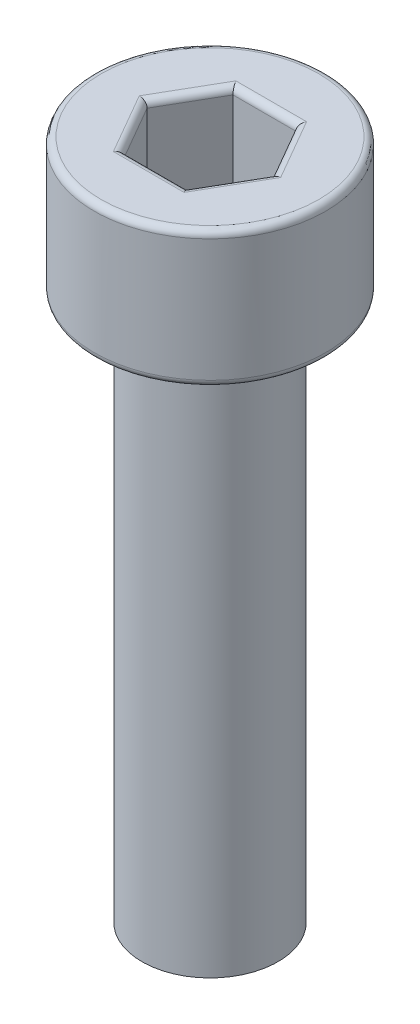
from build123d import *

# Parameters (mm, degrees)
CUT_EXTRUDE1_DEPTH = 3.5
FILLET1_R          = 0.25


with BuildPart() as part:
    # Sketch2 → Revolve1 (revolve)
    with BuildSketch(Plane.XY, mode=Mode.PRIVATE) as revolve1_sk:
        Polygon((0, 5), (4.25, 5), (4.25, 0), (2.5, 0), (2.5, -20), (0, -20), align=None)
    revolve(revolve1_sk.sketch.rotate(Axis((0, 21.322324325, 0), (0, -1, 0)), 180), axis=Axis((0, 21.322324325, 0), (0, -1, 0)))

    # Sketch3 → Cut-Extrude1 (cut)
    with BuildSketch(Plane(origin=(0, 5, 0), x_dir=(1, 0, 0), z_dir=(0, 1, 0))):
        Polygon((2.309401077, 0), (1.154700538, 2), (-1.154700538, 2), (-2.309401077, 0), (-1.154700538, -2), (1.154700538, -2), align=None)
    extrude(amount=-CUT_EXTRUDE1_DEPTH, mode=Mode.SUBTRACT)

    # Fillet1
    fillet1_edges = [part.edges().sort_by_distance(p)[0] for p in [
        (1.732050808, 5, 1),
        (1.732050808, 5, -1),
        (0, 5, -2),
        (-1.732050808, 5, -1),
        (-1.732050808, 5, 1),
        (0, 5, 2),
        (2.5, 0, 0),
        (4.25, 0, 0),
        (4.25, 5, 0),
    ]]
    fillet(fillet1_edges, radius=FILLET1_R)


solid = part.part
